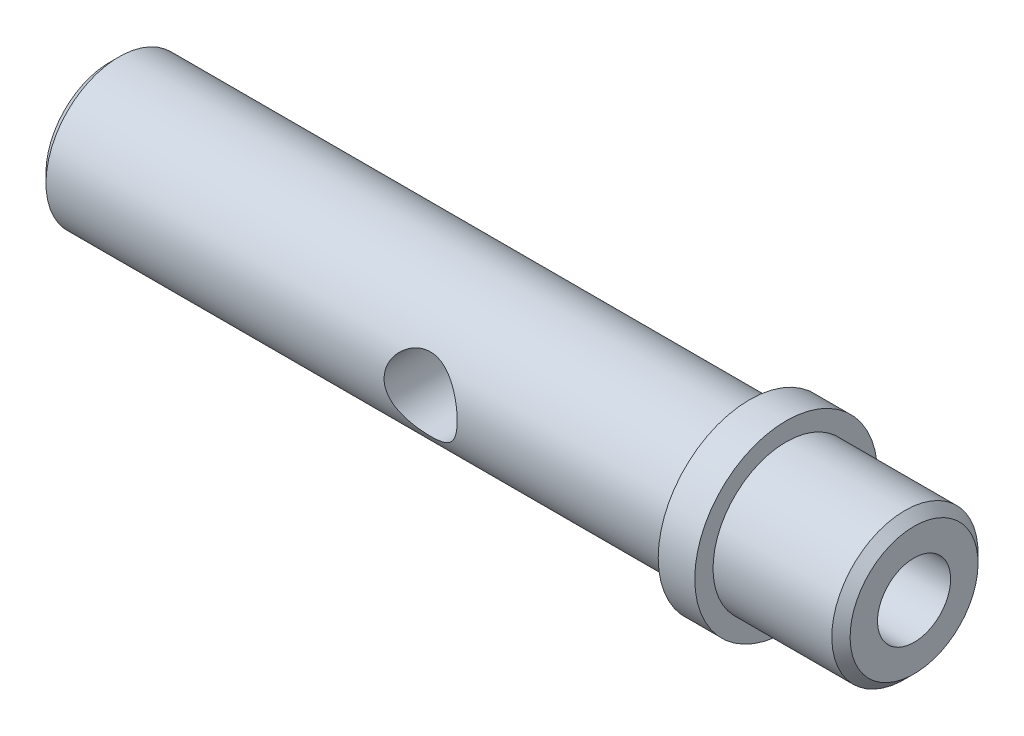
from build123d import *

# Parameters (mm, degrees)
CUT_EXTRUDE_START   = -3.5
CUT_EXTRUDE_1_DEPTH = 10
SKETCH_3_W          = 4
SKETCH_3_H          = 19.670556204
CUT_EXTRUDE_2_DEPTH = 10
CUT_EXTRUDE_START_2 = -29
SKETCH_4_R          = 4
SKETCH_4_R_2        = 2
CUT_EXTRUDE_3_DEPTH = 29
SKETCH_5_R          = 1
CUT_EXTRUDE_4_DEPTH = 5
SKETCH_6_R          = 2
EXTRUDE_1_DEPTH     = 1
EXTRUDE_START       = -4.5
SKETCH_7_R          = 2.5
SKETCH_7_R_2        = 2
EXTRUDE_2_DEPTH     = 1
SKETCH_8_R          = 1
CUT_EXTRUDE_5_DEPTH = 5
CHAMFER_1_SIZE      = 0.25
CHAMFER_2_SIZE      = 0.25


with BuildPart() as part:
    # 草图1 → 旋转2 (revolve)
    with BuildSketch(Plane.XY, mode=Mode.PRIVATE) as revolve_2_sk:
        Polygon((0, 2), (0, 0), (17, 0), (21, 0), (21, 2), (17, 2), (17, 4), (4, 4), (4, 2), align=None)
    revolve(revolve_2_sk.sketch.rotate(Axis((-16.701754386, 0, 0), (1, 0, 0)), 180), axis=Axis((-16.701754386, 0, 0), (1, 0, 0)))

    # 草图2 → 切除-拉伸1 (cut)
    with BuildSketch(Plane.XY.offset(CUT_EXTRUDE_START)):
        Polygon((12.5, -5.827233832), (12.5, 4), (10.5, 4), (8.5, 4), (8.5, -5.827233832), align=None)
    extrude(amount=-CUT_EXTRUDE_1_DEPTH, mode=Mode.SUBTRACT)

    # 草图3 → 切除-拉伸2 (cut)
    with BuildSketch(Plane(origin=(0, 0, 0), x_dir=(1, 0, 0), z_dir=(0, 1, 0)).offset(CUT_EXTRUDE_START)):
        with Locations((10.5, 3.5)):
            Rectangle(SKETCH_3_W, SKETCH_3_H)
    extrude(amount=-CUT_EXTRUDE_2_DEPTH, mode=Mode.SUBTRACT)

    # 草图4 → 切除-拉伸3 (cut)
    with BuildSketch(Plane(origin=(21, 0, 0), x_dir=(0, 0, -1), z_dir=(1, 0, 0)).offset(CUT_EXTRUDE_START_2)):
        Circle(SKETCH_4_R)
        with Locations(Location((0, 0, 0), (0, 0, 270))):
            Circle(SKETCH_4_R_2, mode=Mode.SUBTRACT)
    extrude(amount=CUT_EXTRUDE_3_DEPTH, mode=Mode.SUBTRACT)

    # 草图5 → 切除-拉伸4 (cut, symmetric)
    with BuildSketch(Plane.XY):
        with Locations((10.5, 0)):
            Circle(SKETCH_5_R)
    extrude(amount=CUT_EXTRUDE_4_DEPTH, both=True, mode=Mode.SUBTRACT)

    # 草图6 → 凸台-拉伸1 (add)
    with BuildSketch(Plane(origin=(21, 0, 0), x_dir=(0, 0, -1), z_dir=(1, 0, 0))):
        with Locations(Location((0, 0, 0), (0, 0, 270))):
            Circle(SKETCH_6_R)
    extrude(amount=EXTRUDE_1_DEPTH)

    # 草图7 → 凸台-拉伸2 (add)
    with BuildSketch(Plane(origin=(22, 0, 0), x_dir=(0, 0, -1), z_dir=(1, 0, 0)).offset(EXTRUDE_START)):
        with Locations(Location((0, 0, 0), (0, 0, 90))):
            Circle(SKETCH_7_R)
        with Locations(Location((0, 0, 0), (0, 0, 270))):
            Circle(SKETCH_7_R_2, mode=Mode.SUBTRACT)
    extrude(amount=EXTRUDE_2_DEPTH)

    # 草图8 → 切除-拉伸5 (cut)
    with BuildSketch(Plane(origin=(22, 0, 0), x_dir=(0, 0, -1), z_dir=(1, 0, 0))):
        with Locations(Location((0, 0, 0), (0, 0, 90))):
            Circle(SKETCH_8_R)
    extrude(amount=-CUT_EXTRUDE_5_DEPTH, mode=Mode.SUBTRACT)

    # 倒角1
    chamfer_1_edges = [part.edges().sort_by_distance(p)[0] for p in [
        (22, 2, 0),
    ]]
    chamfer(chamfer_1_edges, length=CHAMFER_1_SIZE)

    # 倒角2
    chamfer_2_edges = [part.edges().sort_by_distance(p)[0] for p in [
        (0, 2, 0),
    ]]
    chamfer(chamfer_2_edges, length=CHAMFER_2_SIZE)


solid = part.part
